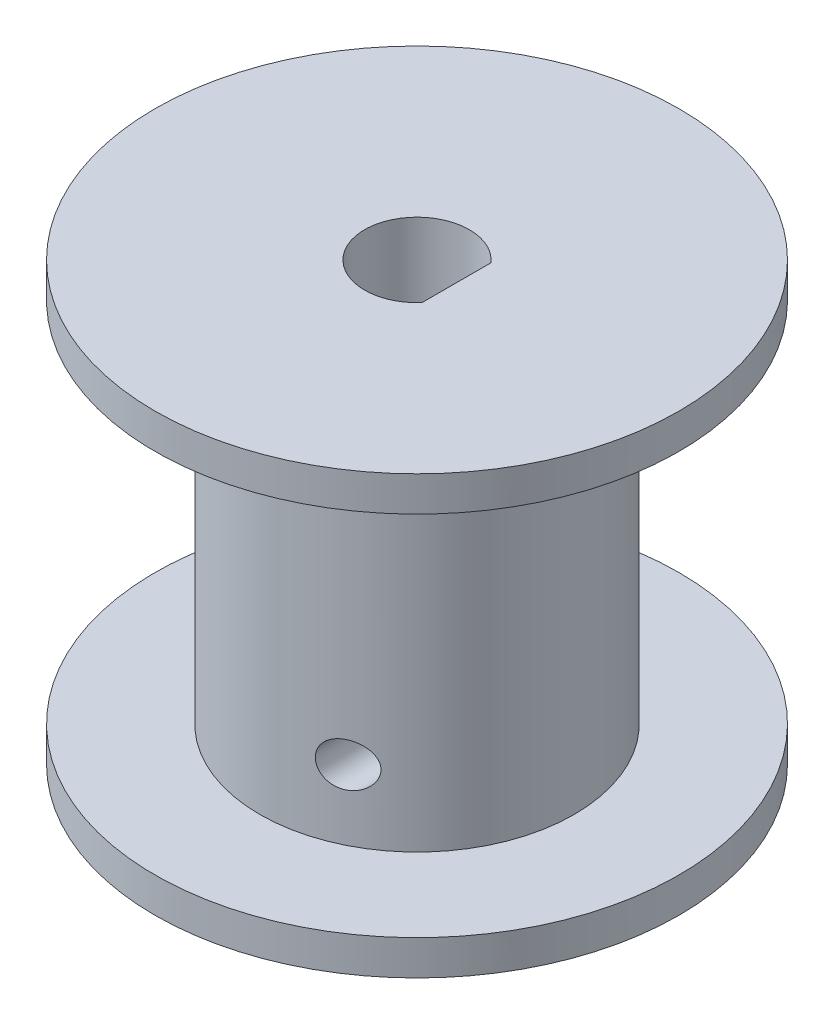
from build123d import *

# Parameters (mm, degrees)
SKETCH1_R               = 15
BOSS_EXTRUDE1_DEPTH     = 25
SKETCH2_R               = 3
CUT_EXTRUDE1_DEPTH      = 25
SKETCH3_W               = 0.8
SKETCH3_H               = 3.945833246
BOSS_EXTRUDE2_DEPTH     = 25
CUT_EXTRUDE2_DEPTH      = 2000
CUT_EXTRUDE2_DEPTH_BACK = 25
SKETCH4_R               = 1.25
SKETCH5_W               = 6
SKETCH5_H               = 21


with BuildPart() as part:
    # Sketch1 → Boss-Extrude1 (new body)
    with BuildSketch(Plane(origin=(0, 0, 0), x_dir=(1, 0, 0), z_dir=(0, 1, 0))):
        with Locations(Location((0, 0, 0), (0, 0, 270))):
            Circle(SKETCH1_R)
    extrude(amount=BOSS_EXTRUDE1_DEPTH)

    # Sketch2 → Cut-Extrude1 (cut)
    with BuildSketch(Plane(origin=(0, 25, 0), x_dir=(1, 0, 0), z_dir=(0, 1, 0))):
        with Locations(Location((0, 0, 0), (0, 0, 270))):
            Circle(SKETCH2_R)
    extrude(amount=-CUT_EXTRUDE1_DEPTH, mode=Mode.SUBTRACT)

    # Sketch3 → Boss-Extrude2 (add)
    with BuildSketch(Plane(origin=(0, 0, 0), x_dir=(1, 0, 0), z_dir=(0, 1, 0))):
        with Locations((2.66, 0)):
            Rectangle(SKETCH3_W, SKETCH3_H)
    extrude(amount=BOSS_EXTRUDE2_DEPTH)

    # Sketch4 → Cut-Extrude2 (cut, two sides: drawn at the far end of the back side and taken through both)
    with BuildSketch(Plane.XY.offset(-CUT_EXTRUDE2_DEPTH_BACK)):
        with Locations(Location((4, 6, 0), (0, 0, 180))):
            Circle(SKETCH4_R)
    extrude(amount=CUT_EXTRUDE2_DEPTH + CUT_EXTRUDE2_DEPTH_BACK, mode=Mode.SUBTRACT)

    # Sketch5 → Cut-Revolve1 (revolve, cut)
    with BuildSketch(Plane.XY, mode=Mode.PRIVATE) as cut_revolve1_sk:
        with Locations((12, 12.5)):
            Rectangle(SKETCH5_W, SKETCH5_H)
    revolve(cut_revolve1_sk.sketch.rotate(Axis((0, 0, 0), (0, 1, 0)), 90), axis=Axis((0, 0, 0), (0, 1, 0)), mode=Mode.SUBTRACT)


solid = part.part
